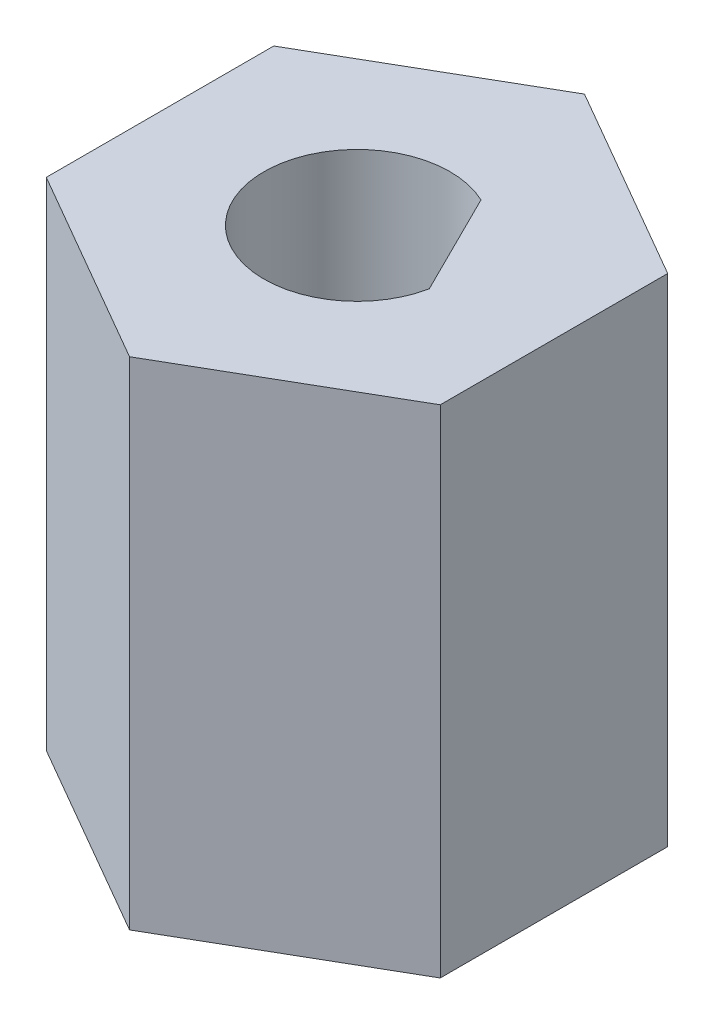
from build123d import *

# Parameters (mm, degrees)
BOSS_EXTRUDE1_DEPTH     = 16.002
CUT_EXTRUDE1_DEPTH      = 3.175
CUT_EXTRUDE1_DEPTH_BACK = 30


with BuildPart() as part:
    # Sketch1 → Boss-Extrude1 (new body)
    with BuildSketch(Plane(origin=(0, 0, 0), x_dir=(1, 0, 0), z_dir=(0, 1, 0))):
        Polygon((0, -7.332348419), (6.35, -3.666174209), (6.35, 3.666174209), (0, 7.332348419), (-6.35, 3.666174209), (-6.35, -3.666174209), align=None)
    extrude(amount=BOSS_EXTRUDE1_DEPTH)

    # Sketch2 → Cut-Extrude1 (cut, two sides: drawn at the far end of the back side and taken through both)
    with BuildSketch(Plane(origin=(0, 16.002, 0), x_dir=(1, 0, 0), z_dir=(0, 1, 0)).offset(-CUT_EXTRUDE1_DEPTH_BACK)):
        with BuildLine():
            ThreePointArc((1.286214253, 2.710286497), (-2.68613187, -1.335924989), (2.937388201, -0.609713503))
            Line((2.937388201, -0.609713503), (1.286214253, 2.710286497))
        make_face()
    extrude(amount=CUT_EXTRUDE1_DEPTH + CUT_EXTRUDE1_DEPTH_BACK, mode=Mode.SUBTRACT)


solid = part.part
